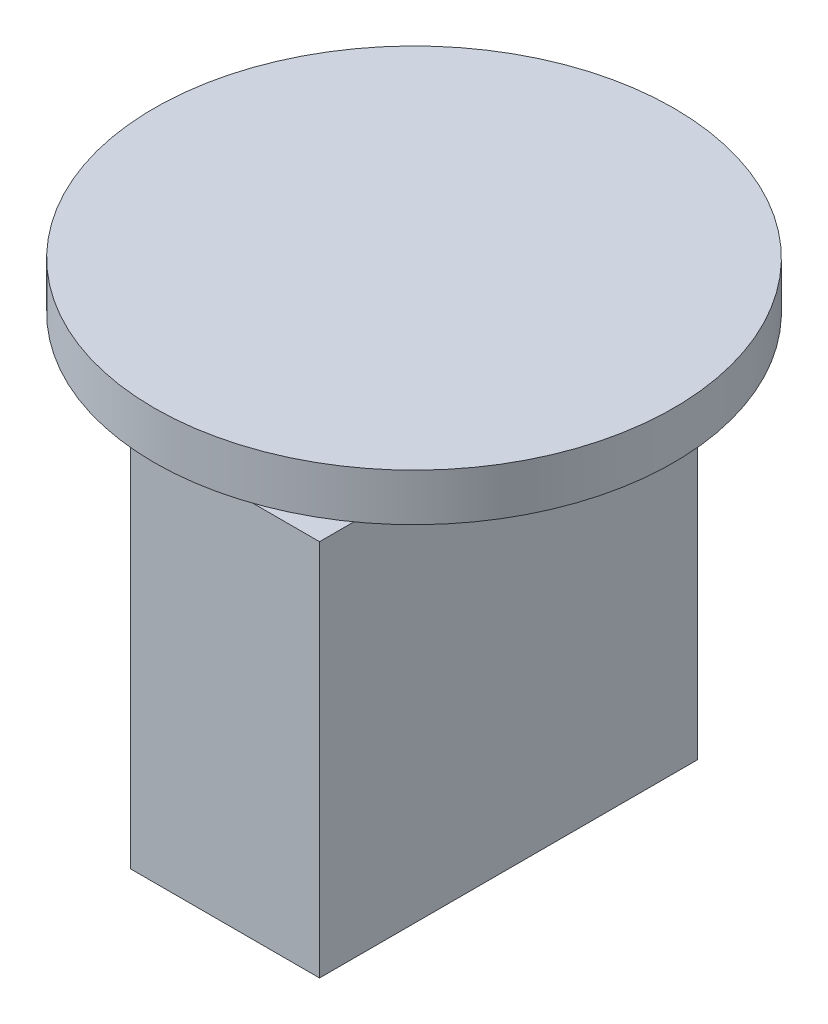
from build123d import *

# Parameters (mm, degrees)
SKETCH1_W           = 25.4
SKETCH1_H           = 50.8
BOSS_EXTRUDE1_DEPTH = 50.8
SKETCH2_R           = 2.54
BOSS_EXTRUDE2_DEPTH = 7.62
SKETCH3_R           = 34.925
BOSS_EXTRUDE3_DEPTH = 6.35


with BuildPart() as part:
    # Sketch1 → Boss-Extrude1 (new body)
    with BuildSketch(Plane(origin=(0, 0, 0), x_dir=(1, 0, 0), z_dir=(0, 1, 0))):
        with Locations((-12.7, 25.4)):
            Rectangle(SKETCH1_W, SKETCH1_H)
    extrude(amount=BOSS_EXTRUDE1_DEPTH)

    # Sketch2 → Boss-Extrude2 (add)
    with BuildSketch(Plane(origin=(0, 50.8, 0), x_dir=(1, 0, 0), z_dir=(0, 1, 0))):
        with Locations(Location((-12.7, 25.4, 0), (0, 0, 90))):
            Circle(SKETCH2_R)
    extrude(amount=BOSS_EXTRUDE2_DEPTH)

    # Sketch3 → Boss-Extrude3 (add)
    with BuildSketch(Plane(origin=(0, 58.42, 0), x_dir=(1, 0, 0), z_dir=(0, 1, 0))):
        with Locations(Location((-12.7, 25.4, 0), (0, 0, 270))):
            Circle(SKETCH3_R)
    extrude(amount=BOSS_EXTRUDE3_DEPTH)


solid = part.part
